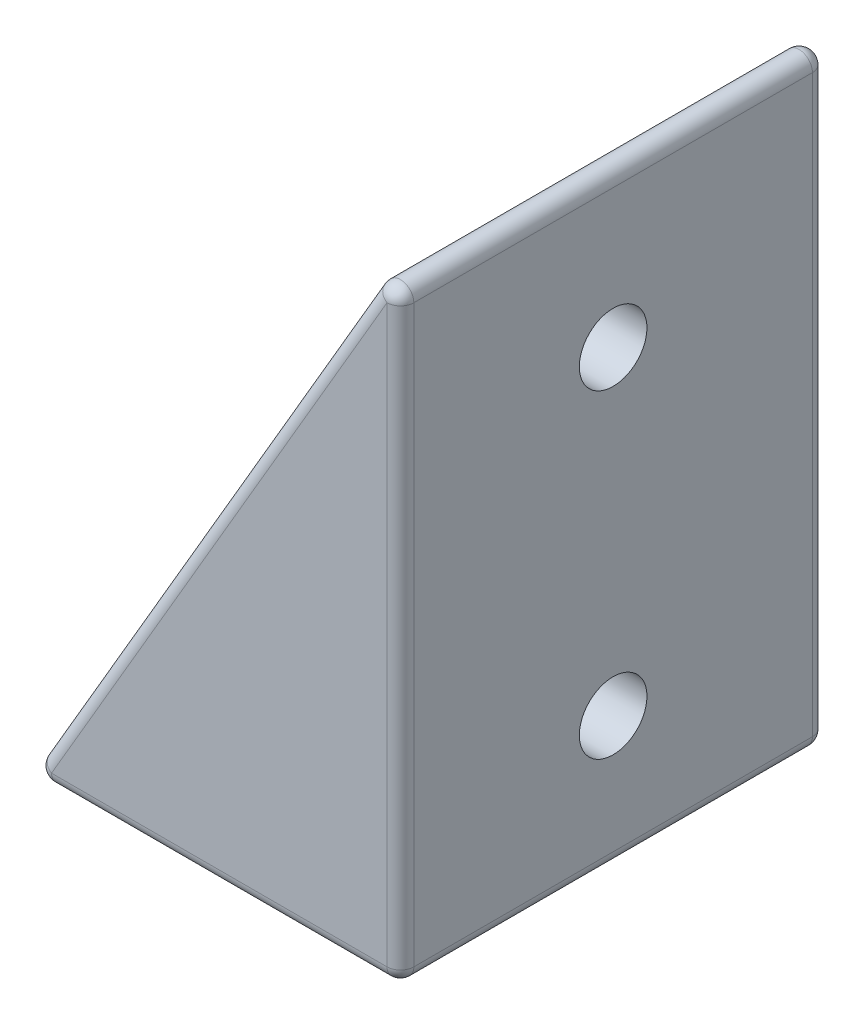
from build123d import *

# Parameters (mm, degrees)
BOSS_EXTRUDE1_DEPTH = 25.4
FILLET1_R           = 0.8
SKETCH2_R           = 2.0193
CUT_EXTRUDE1_DEPTH  = 50.8


with BuildPart() as part:
    # Sketch1 → Boss-Extrude1 (new body)
    with BuildSketch(Plane.XY):
        Polygon((0, 0), (0, 38.1), (-22.225, 0), align=None)
    extrude(amount=BOSS_EXTRUDE1_DEPTH)

    # Fillet1
    fillet1_edges = [part.edges().sort_by_distance(p)[0] for p in [
        (-11.1125, 19.05, 25.4),
        (-11.1125, 19.05, 0),
        (0, 19.05, 0),
        (-11.1125, 0, 0),
        (-11.1125, 0, 25.4),
        (-22.225, 0, 12.7),
        (0, 38.1, 12.7),
        (0, 0, 12.7),
        (0, 19.05, 25.4),
    ]]
    fillet(fillet1_edges, radius=FILLET1_R)

    # Sketch2 → Cut-Extrude1 (cut)
    with BuildSketch(Plane(origin=(0, 0, 0), x_dir=(0, 0, -1), z_dir=(1, 0, 0))):
        with Locations((-12.7, 26.885863544)):
            Circle(SKETCH2_R)
        with Locations((-12.7, 7.835863544)):
            Circle(SKETCH2_R)
    extrude(amount=-CUT_EXTRUDE1_DEPTH, mode=Mode.SUBTRACT)


solid = part.part
